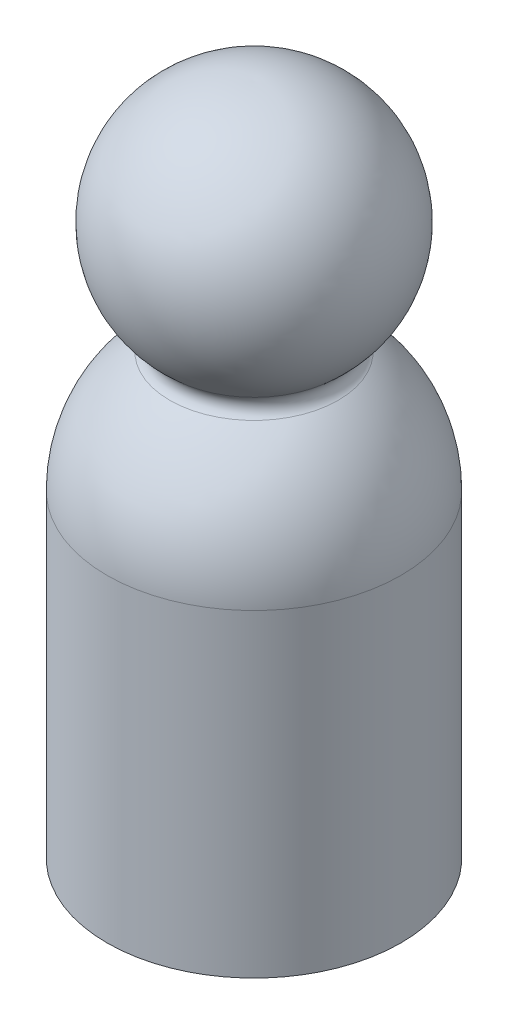
from build123d import *


with BuildPart() as part:
    # Sketch1 → Revolve1 (revolve)
    with BuildSketch(Plane.XY, mode=Mode.PRIVATE) as revolve1_sk:
        with BuildLine():
            Line((12, 22.244597056), (12, -3.755402944))
            Line((12, -3.755402944), (0, -3.755402944))
            Line((0, -3.755402944), (0, 51.240203006))
            ThreePointArc((0, 51.240203006), (9.622564623, 44.853326528), (6.805356461, 33.652912283))
            ThreePointArc((6.805356461, 33.652912283), (6.457448916, 32.844803734), (6.882692892, 32.074578671))
            ThreePointArc((6.882692892, 32.074578671), (10.644066768, 27.785701878), (12, 22.244597056))
        make_face()
    revolve(revolve1_sk.sketch.rotate(Axis((0, 0, 0), (0, 1, 0)), 90), axis=Axis((0, 0, 0), (0, 1, 0)))


solid = part.part
